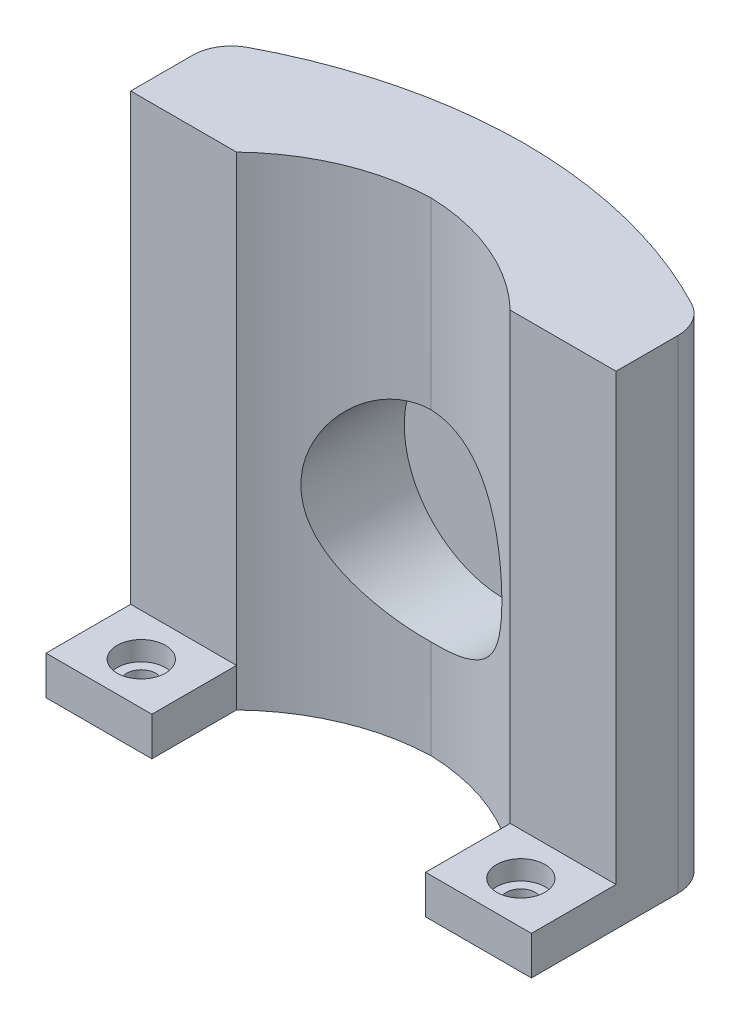
from build123d import *

# Parameters (mm, degrees)
BOSS_EXTRUDE2_DEPTH = 63.5
SKETCH1_4_W         = 13.909610768
SKETCH1_4_H         = 11.124423297
BOSS_EXTRUDE3_DEPTH = 5.08
SKETCH2_R           = 3.175
CUT_EXTRUDE1_DEPTH  = 2.54
SKETCH3_R           = 1.905
CUT_EXTRUDE2_DEPTH  = 94.48175649
CUT_EXTRUDE3_START  = -43.382423
SKETCH4_R           = 13.208
CUT_EXTRUDE3_DEPTH  = 17.272
FILLET1_R           = 5.08


with BuildPart() as part:
    # Sketch1 → Boss-Extrude2 (new body)
    with BuildSketch(Plane(origin=(0, 0, 0), x_dir=(1, 0, 0), z_dir=(0, 1, 0))):
        with BuildLine():
            ThreePointArc((0, 63.287802336), (-16.535030554, 61.029206749), (-31.896257962, 54.506846594))
            Line((-31.896257962, 54.506846594), (-31.896257962, 43.382423297))
            Line((-31.896257962, 43.382423297), (-17.986647194, 43.382423297))
            ThreePointArc((-17.986647194, 43.382423297), (-9.699677374, 48.846444583), (0, 50.954917077))
            ThreePointArc((0, 50.954917077), (9.699677374, 48.846444583), (17.986647194, 43.382423297))
            Line((17.986647194, 43.382423297), (31.896257962, 43.382423297))
            Line((31.896257962, 43.382423297), (31.896257962, 54.506846594))
            ThreePointArc((31.896257962, 54.506846594), (16.535030554, 61.029206749), (0, 63.287802336))
        make_face()
    extrude(amount=BOSS_EXTRUDE2_DEPTH)

    # Sketch1<4> → Boss-Extrude3 (add)
    with BuildSketch(Plane(origin=(0, 0, 0), x_dir=(1, 0, 0), z_dir=(0, 1, 0))):
        with Locations((-24.941452578, 37.820211649)):
            Rectangle(SKETCH1_4_W, SKETCH1_4_H)
        with Locations((24.941452578, 37.820211649)):
            Rectangle(SKETCH1_4_W, SKETCH1_4_H)
    extrude(amount=BOSS_EXTRUDE3_DEPTH)

    # Sketch2 → Cut-Extrude1 (cut)
    with BuildSketch(Plane(origin=(0, 5.08, 0), x_dir=(1, 0, 0), z_dir=(0, 1, 0))):
        with Locations(Location((-24.941452578, 37.820211648, 0), (0, 0, 270))):
            Circle(SKETCH2_R)
        with Locations(Location((24.941452578, 37.820211648, 0), (0, 0, 90))):
            Circle(SKETCH2_R)
    extrude(amount=-CUT_EXTRUDE1_DEPTH, mode=Mode.SUBTRACT)

    # Sketch3 → Cut-Extrude2 (cut, through all)
    with BuildSketch(Plane(origin=(0, 2.54, 0), x_dir=(1, 0, 0), z_dir=(0, 1, 0))):
        with Locations(Location((-24.941452578, 37.820211648, 0), (0, 0, 270))):
            Circle(SKETCH3_R)
        with Locations(Location((24.941452578, 37.820211648, 0), (0, 0, 90))):
            Circle(SKETCH3_R)
    extrude(amount=-CUT_EXTRUDE2_DEPTH, mode=Mode.SUBTRACT)

    # Sketch4 → Cut-Extrude3 (cut)
    with BuildSketch(Plane.XY.offset(CUT_EXTRUDE3_START)):
        with Locations((0, 26.175500537)):
            Circle(SKETCH4_R)
    extrude(amount=-CUT_EXTRUDE3_DEPTH, mode=Mode.SUBTRACT)

    # Fillet1
    fillet1_edges = [part.edges().sort_by_distance(p)[0] for p in [
        (31.896257962, 31.75, -54.506846594),
        (-31.896257962, 31.75, -54.506846594),
    ]]
    fillet(fillet1_edges, radius=FILLET1_R)


solid = part.part
